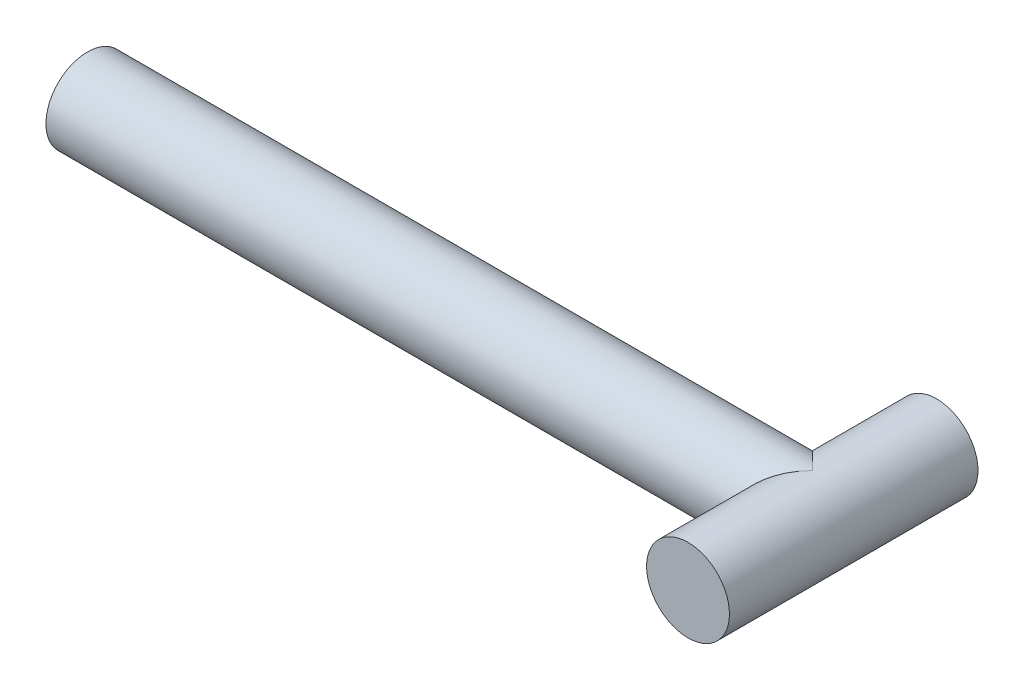
from build123d import *

# Parameters (mm, degrees)
SKETCH1_R                = 4
BOSS_EXTRUDE1_DEPTH      = 70
BOSS_EXTRUDE2_DEPTH      = 12
BOSS_EXTRUDE2_DEPTH_BACK = 12
SKETCH2_R                = 4


with BuildPart() as part:
    # Sketch1 → Boss-Extrude1 (new body)
    with BuildSketch(Plane(origin=(0, 0, 0), x_dir=(0, 0, -1), z_dir=(1, 0, 0))):
        Circle(SKETCH1_R)
    extrude(amount=-BOSS_EXTRUDE1_DEPTH)

    # Sketch2 → Boss-Extrude2 (add, two sides: drawn at the far end of the back side and taken through both)
    with BuildSketch(Plane.XY.offset(-BOSS_EXTRUDE2_DEPTH_BACK)):
        Circle(SKETCH2_R)
    extrude(amount=BOSS_EXTRUDE2_DEPTH + BOSS_EXTRUDE2_DEPTH_BACK)


solid = part.part
